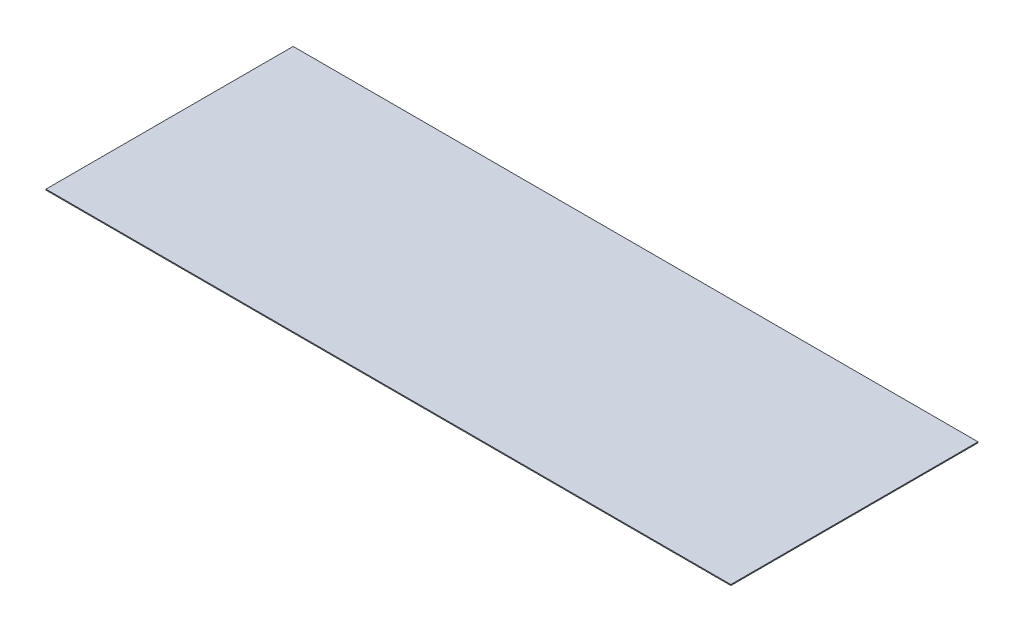
from build123d import *

# Parameters (mm, degrees)
SKETCH1_W           = 1150
SKETCH1_H           = 415
BOSS_EXTRUDE1_DEPTH = 1.5875


with BuildPart() as part:
    # Sketch1 → Boss-Extrude1 (new body)
    with BuildSketch(Plane(origin=(0, 0, 0), x_dir=(1, 0, 0), z_dir=(0, 1, 0))):
        with Locations((47.8553137, 33.249039693)):
            Rectangle(SKETCH1_W, SKETCH1_H)
    extrude(amount=BOSS_EXTRUDE1_DEPTH)


solid = part.part
